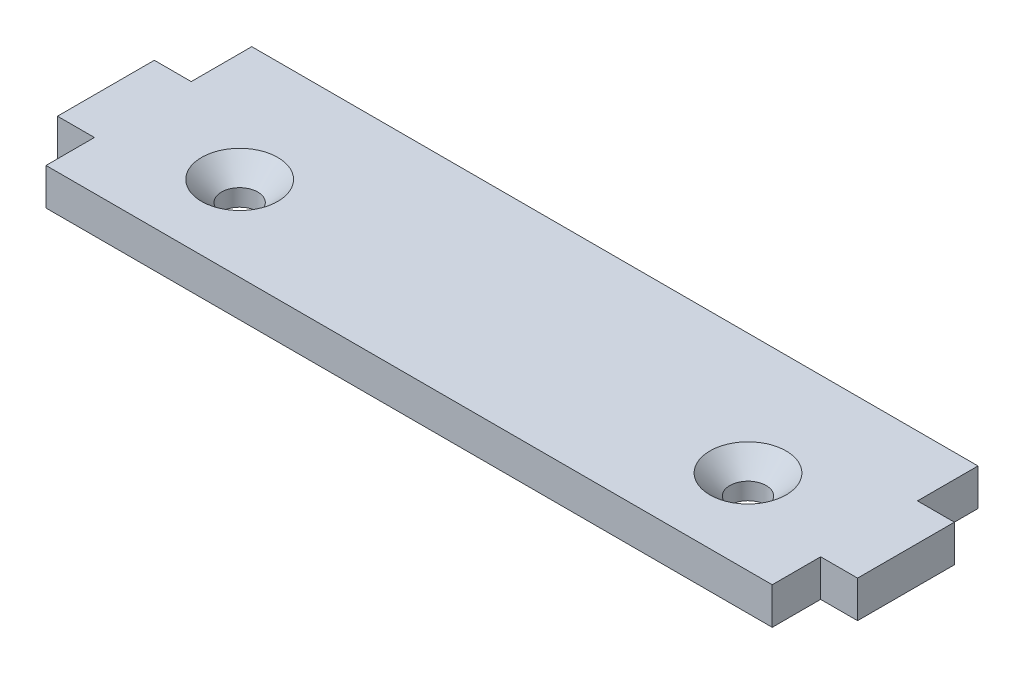
from build123d import *

# Parameters (mm, degrees)
SKETCH1_R           = 1.5
BOSS_EXTRUDE1_DEPTH = 3.05


with BuildPart() as part:
    # Sketch1 → Boss-Extrude1 (new body)
    with BuildSketch(Plane(origin=(0, 0, 0), x_dir=(1, 0, 0), z_dir=(0, 1, 0))):
        Polygon((3.05, 17), (3.05, 12), (0, 12), (0, 4), (3.05, 4), (3.05, 0), (63.05, 0), (63.05, 4), (66.1, 4), (66.1, 12), (63.05, 12), (63.05, 17), align=None)
        with Locations(Location((54.05, 7, 0), (0, 0, 270))):
            Circle(SKETCH1_R, mode=Mode.SUBTRACT)
        with Locations(Location((12.05, 7, 0), (0, 0, 270))):
            Circle(SKETCH1_R, mode=Mode.SUBTRACT)
    extrude(amount=BOSS_EXTRUDE1_DEPTH)

    # Sketch5 → CSK for M3 Flat Head Machine Screw1 (revolve, cut)
    with BuildSketch(Plane(origin=(12.05, 3.05, -7), x_dir=(0, 0, 1), z_dir=(1, 0, 0))):
        Polygon((0, 0), (0, 3.05), (1.5, 3.05), (1.5, 1.65), (3.15, 0), align=None)
    revolve(axis=Axis((12.05, 9.4, -7), (0, -1, 0)), mode=Mode.SUBTRACT)

    # Sketch7 → CSK for M3 Flat Head Machine Screw2 (revolve, cut)
    with BuildSketch(Plane(origin=(54.05, 3.05, -7), x_dir=(0, 0, 1), z_dir=(1, 0, 0))):
        Polygon((0, 0), (0, 3.05), (1.5, 3.05), (1.5, 1.65), (3.15, 0), align=None)
    revolve(axis=Axis((54.05, 9.4, -7), (0, -1, 0)), mode=Mode.SUBTRACT)


solid = part.part
